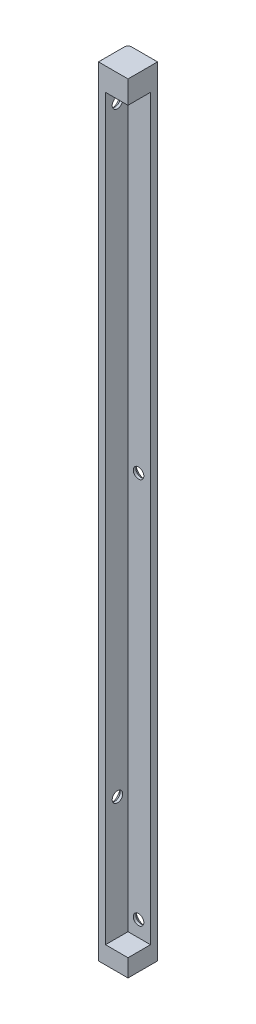
from build123d import *

# Parameters (mm, degrees)
BOSS_EXTRUDE1_DEPTH                                 = 221.5
CSK_FOR_M3_COUNTERSUNK_FLAT_HEAD_SCREW1_D           = 3
CSK_FOR_M3_COUNTERSUNK_FLAT_HEAD_SCREW1_CSINK_D     = 5.5
CSK_FOR_M3_COUNTERSUNK_FLAT_HEAD_SCREW1_CSINK_ANGLE = 90
CSK_FOR_M3_COUNTERSUNK_FLAT_HEAD_SCREW4_D           = 3
CSK_FOR_M3_COUNTERSUNK_FLAT_HEAD_SCREW4_CSINK_D     = 5.5
CSK_FOR_M3_COUNTERSUNK_FLAT_HEAD_SCREW4_CSINK_ANGLE = 90
SKETCH12_W                                          = 8
SKETCH12_H                                          = 7
BOSS_EXTRUDE2_DEPTH                                 = 5.5
CUT_EXTRUDE1_DEPTH                                  = 359
BOSS_EXTRUDE3_DEPTH                                 = 3
BOSS_EXTRUDE4_DEPTH                                 = 2.5
BOSS_EXTRUDE4_DEPTH_BACK                            = 6
SKETCH19_W                                          = 0.6
SKETCH19_H                                          = 227
CUT_EXTRUDE2_DEPTH                                  = 10
SKETCH20_W                                          = 13.889043849
SKETCH20_H                                          = 2
CUT_EXTRUDE3_DEPTH                                  = 10
SKETCH21_W                                          = 0.6
SKETCH21_H                                          = 225
CUT_EXTRUDE4_DEPTH                                  = 10
SKETCH22_W                                          = 8.4
SKETCH22_H                                          = 5.5
CUT_EXTRUDE5_DEPTH                                  = 10
BOSS_EXTRUDE5_DEPTH                                 = 2
BOSS_EXTRUDE6_DEPTH                                 = 221.5
FILLET1_R                                           = 1


with BuildPart() as part:
    # Sketch1 → Boss-Extrude1 (new body)
    with BuildSketch(Plane(origin=(0, 0, 0), x_dir=(1, 0, 0), z_dir=(0, 1, 0))):
        Polygon((0, 0), (0, 9), (9, 9), (9, 7), (2, 7), (2, 0), align=None)
    extrude(amount=BOSS_EXTRUDE1_DEPTH)

    # CSK for M3 Countersunk Flat Head Screw1 (through all)
    with Locations(Plane.ZY):
        with Locations((-4, 211.25), (-4, 40.25)):
            CounterSinkHole(CSK_FOR_M3_COUNTERSUNK_FLAT_HEAD_SCREW1_D / 2, CSK_FOR_M3_COUNTERSUNK_FLAT_HEAD_SCREW1_CSINK_D / 2, counter_sink_angle=CSK_FOR_M3_COUNTERSUNK_FLAT_HEAD_SCREW1_CSINK_ANGLE)

    # CSK for M3 Countersunk Flat Head Screw4 (through all)
    with Locations(Plane(origin=(0, 0, -9), x_dir=(-1, 0, 0), z_dir=(0, 0, -1))):
        with Locations((-5, 120), (-5, 10)):
            CounterSinkHole(CSK_FOR_M3_COUNTERSUNK_FLAT_HEAD_SCREW4_D / 2, CSK_FOR_M3_COUNTERSUNK_FLAT_HEAD_SCREW4_CSINK_D / 2, counter_sink_angle=CSK_FOR_M3_COUNTERSUNK_FLAT_HEAD_SCREW4_CSINK_ANGLE)

    # Sketch12 → Boss-Extrude2 (add)
    with BuildSketch(Plane.XZ):
        with Locations((5, -3.5)):
            Rectangle(SKETCH12_W, SKETCH12_H)
    extrude(amount=-BOSS_EXTRUDE2_DEPTH)

    # Sketch13 → Cut-Extrude1 (cut)
    with BuildSketch(Plane(origin=(0, 221.5, 0), x_dir=(1, 0, 0), z_dir=(0, 1, 0))):
        Polygon((0, 8), (1, 9), (0, 9), align=None)
    extrude(amount=-CUT_EXTRUDE1_DEPTH, mode=Mode.SUBTRACT)

    # Sketch14 → Boss-Extrude3 (add)
    with BuildSketch(Plane.XZ):
        Polygon((0, 0), (9, 0), (9, -9), (1, -9), (0, -8), align=None)
    extrude(amount=BOSS_EXTRUDE3_DEPTH)

    # Sketch18 → Boss-Extrude4 (add, two sides: drawn at the far end of the back side and taken through both)
    with BuildSketch(Plane(origin=(0, 221.5, 0), x_dir=(1, 0, 0), z_dir=(0, 1, 0)).offset(-BOSS_EXTRUDE4_DEPTH_BACK)):
        Polygon((0, 0), (9, 0), (9, 9), (1, 9), (0, 8), align=None)
    extrude(amount=BOSS_EXTRUDE4_DEPTH + BOSS_EXTRUDE4_DEPTH_BACK)

    # Sketch19 → Cut-Extrude2 (cut)
    with BuildSketch(Plane(origin=(0, 0, -9), x_dir=(-1, 0, 0), z_dir=(0, 0, -1))):
        with Locations((-8.7, 110.5)):
            Rectangle(SKETCH19_W, SKETCH19_H)
    extrude(amount=-CUT_EXTRUDE2_DEPTH, mode=Mode.SUBTRACT)

    # Sketch20 → Cut-Extrude3 (cut)
    with BuildSketch(Plane.XY):
        with Locations((1.455478075, 223)):
            Rectangle(SKETCH20_W, SKETCH20_H)
    extrude(amount=-CUT_EXTRUDE3_DEPTH, mode=Mode.SUBTRACT)

    # Sketch21 → Cut-Extrude4 (cut)
    with BuildSketch(Plane.ZY):
        with Locations((-0.3, 109.5)):
            Rectangle(SKETCH21_W, SKETCH21_H)
    extrude(amount=-CUT_EXTRUDE4_DEPTH, mode=Mode.SUBTRACT)

    # Sketch22 → Cut-Extrude5 (cut)
    with BuildSketch(Plane(origin=(8.4, 0, 0), x_dir=(0, 0, -1), z_dir=(1, 0, 0))):
        with Locations((4.8, -0.25)):
            Rectangle(SKETCH22_W, SKETCH22_H)
    extrude(amount=-CUT_EXTRUDE5_DEPTH, mode=Mode.SUBTRACT)

    # Sketch23 → Boss-Extrude5 (add)
    with BuildSketch(Plane.XZ.offset(-2.5)):
        Polygon((1, -9), (8.4, -9), (8.4, -0.6), (0, -0.6), (0, -8), align=None)
    extrude(amount=BOSS_EXTRUDE5_DEPTH)

    # Sketch24 → Boss-Extrude6 (add)
    with BuildSketch(Plane(origin=(0, 222, 0), x_dir=(1, 0, 0), z_dir=(0, 1, 0))):
        Polygon((0, 8), (1, 9), (0, 9), align=None)
    extrude(amount=-BOSS_EXTRUDE6_DEPTH)

    # Fillet1
    fillet1_edges = [part.edges().sort_by_distance(p)[0] for p in [
        (0, 111.25, -9),
    ]]
    fillet(fillet1_edges, radius=FILLET1_R)


solid = part.part
